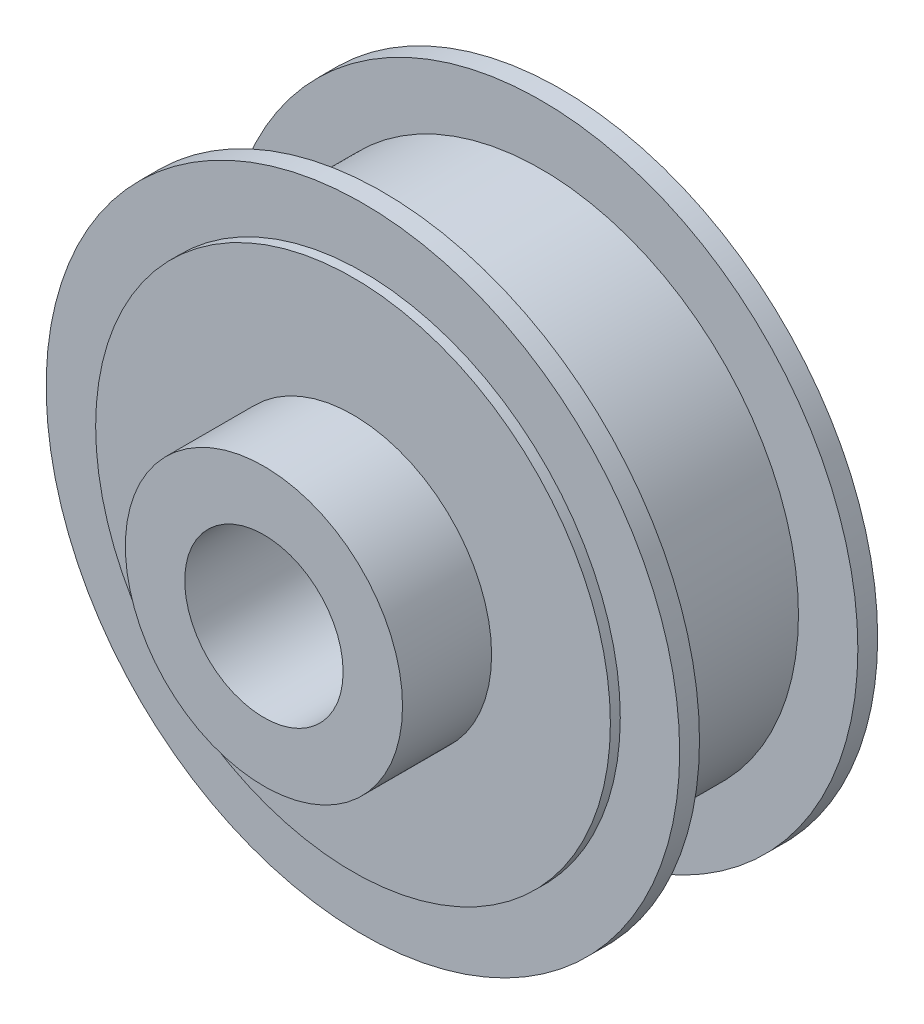
from build123d import *

# Parameters (mm, degrees)
ESQUISSE1_R             = 16
BOSS_EXTRU_1_DEPTH      = 1
ESQUISSE2_R             = 13
BOSS_EXTRU_2_DEPTH      = 8
ESQUISSE3_R             = 16
BOSS_EXTRU_3_DEPTH      = 1
ESQUISSE4_R             = 7
BOSS_EXTRU_4_DEPTH      = 5
ESQUISSE6_R             = 13
BOSS_EXTRU_5_DEPTH      = 0.5
BOSS_EXTRU_6_START      = 0.5
ESQUISSE7_R             = 13
BOSS_EXTRU_6_DEPTH      = 0.5
ESQUISSE8_R             = 4
ENL_V_MAT_EXTRU_2_DEPTH = 16


with BuildPart() as part:
    # Esquisse1 → Boss.-Extru.1 (new body)
    with BuildSketch(Plane.XY):
        Circle(ESQUISSE1_R)
    extrude(amount=BOSS_EXTRU_1_DEPTH)

    # Esquisse2 → Boss.-Extru.2 (add)
    with BuildSketch(Plane.XY.offset(1)):
        Circle(ESQUISSE2_R)
    extrude(amount=BOSS_EXTRU_2_DEPTH)

    # Esquisse3 → Boss.-Extru.3 (add)
    with BuildSketch(Plane.XY.offset(9)):
        Circle(ESQUISSE3_R)
    extrude(amount=BOSS_EXTRU_3_DEPTH)

    # Esquisse4 → Boss.-Extru.4 (add)
    with BuildSketch(Plane.XY.offset(10)):
        Circle(ESQUISSE4_R)
    extrude(amount=BOSS_EXTRU_4_DEPTH)

    # Esquisse6 → Boss.-Extru.5 (add)
    with BuildSketch(Plane.XY.offset(10)):
        Circle(ESQUISSE6_R)
    extrude(amount=BOSS_EXTRU_5_DEPTH)

    # Esquisse7 → Boss.-Extru.6 (add)
    with BuildSketch(Plane(origin=(0, 0, 0), x_dir=(-1, 0, 0), z_dir=(0, 0, -1)).offset(BOSS_EXTRU_6_START)):
        with Locations(Location((0, 0, 0), (0, 0, 180))):
            Circle(ESQUISSE7_R)
    extrude(amount=-BOSS_EXTRU_6_DEPTH)

    # Esquisse8 → Enlèv. mat.-Extru.2 (cut)
    with BuildSketch(Plane.XY.offset(15)):
        Circle(ESQUISSE8_R)
    extrude(amount=-ENL_V_MAT_EXTRU_2_DEPTH, mode=Mode.SUBTRACT)


solid = part.part
